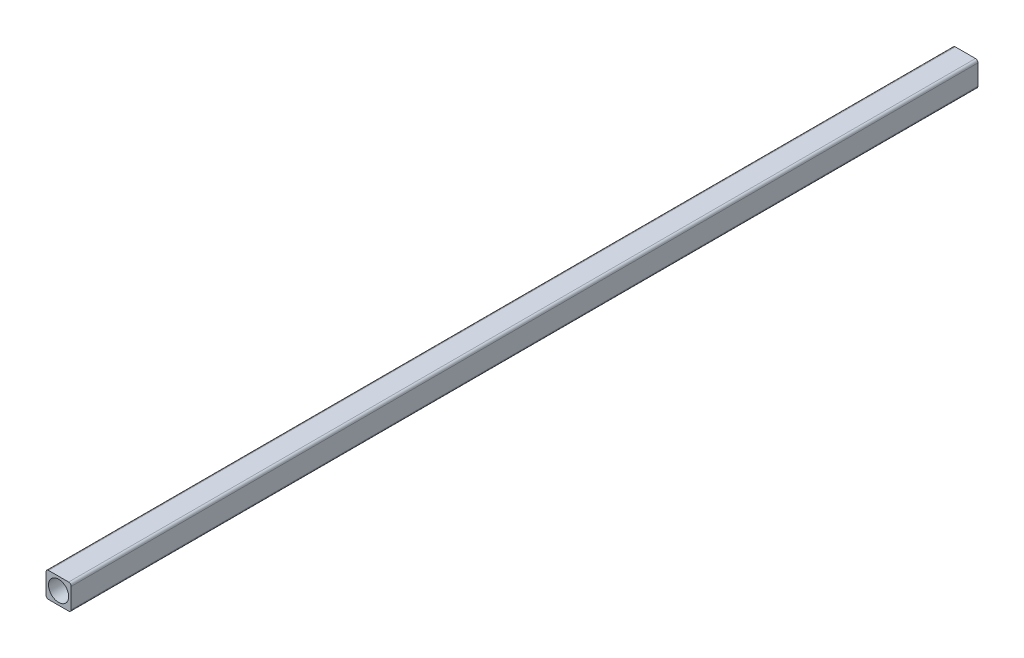
from build123d import *

# Parameters (mm, degrees)
BOSS_EXTRUDE1_DEPTH      = 180
BOSS_EXTRUDE1_DEPTH_BACK = 180
SKETCH1_W                = 10
SKETCH1_H                = 10
SKETCH1_R                = 4
FILLET1_R                = 1


with BuildPart() as part:
    # Sketch1 → Boss-Extrude1 (new, two sides: drawn at the far end of the back side and taken through both)
    with BuildSketch(Plane.XY.offset(-BOSS_EXTRUDE1_DEPTH_BACK)):
        Rectangle(SKETCH1_W, SKETCH1_H)
        Circle(SKETCH1_R, mode=Mode.SUBTRACT)
    extrude(amount=BOSS_EXTRUDE1_DEPTH + BOSS_EXTRUDE1_DEPTH_BACK)

    # Fillet1
    fillet1_edges = [part.edges().sort_by_distance(p)[0] for p in [
        (-5, -5, 0),
        (5, -5, 0),
        (-5, 5, 0),
        (5, 5, 0),
    ]]
    fillet(fillet1_edges, radius=FILLET1_R)


solid = part.part
